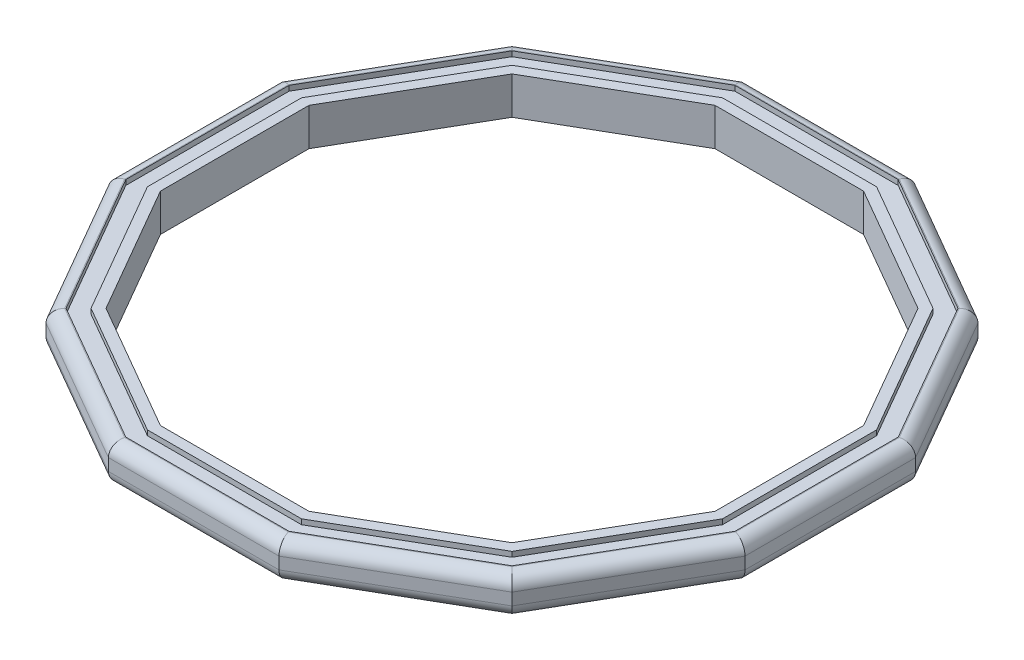
from build123d import *

# Parameters (mm, degrees)
EXTRUDE_1_DEPTH          = 4.4
CUT_EXTRUDE_1_DEPTH      = 0.6
FILLET_1_R               = 1.5
CUT_EXTRUDE_2_DEPTH      = 53.909660275
CUT_EXTRUDE_2_DEPTH_BACK = 53.909660275


with BuildPart() as part:
    # 스케치1 → 보스-돌출1 (new body)
    with BuildSketch(Plane(origin=(0, 0, 0), x_dir=(1, 0, 0), z_dir=(0, 1, 0))):
        Polygon((27.293187568, -27.293187568), (37.283187568, -9.99), (37.283187568, 9.99), (27.293187568, 27.293187568), (9.99, 37.283187568), (-9.99, 37.283187568), (-27.293187568, 27.293187568), (-37.283187568, 9.99), (-37.283187568, -9.99), (-27.293187568, -27.293187568), (-9.99, -37.283187568), (9.99, -37.283187568), align=None)
    extrude(amount=EXTRUDE_1_DEPTH)

    # 스케치2 → 컷-돌출1 (cut)
    with BuildSketch(Plane(origin=(0, 4.4, 0), x_dir=(1, 0, 0), z_dir=(0, 1, 0))):
        Polygon((-26.120860153, 26.120860153), (-35.681758538, 9.560898385), (-35.681758538, -9.560898385), (-26.120860153, -26.120860153), (-9.560898385, -35.681758538), (9.560898385, -35.681758538), (26.120860153, -26.120860153), (35.681758538, -9.560898385), (35.681758538, 9.560898385), (26.120860153, 26.120860153), (9.560898385, 35.681758538), (-9.560898385, 35.681758538), align=None)
        Polygon((24.656758538, -24.656758538), (33.681758538, -9.025), (33.681758538, 9.025), (24.656758538, 24.656758538), (9.025, 33.681758538), (-9.025, 33.681758538), (-24.656758538, 24.656758538), (-33.681758538, 9.025), (-33.681758538, -9.025), (-24.656758538, -24.656758538), (-9.025, -33.681758538), (9.025, -33.681758538), align=None, mode=Mode.SUBTRACT)
    cut_extrude_1 = extrude(amount=-CUT_EXTRUDE_1_DEPTH, mode=Mode.SUBTRACT)

    # 필렛1
    fillet_1_edges = [part.edges().sort_by_distance(p)[0] for p in [
        (0, 0, 37.283187568),
        (-18.641593784, 0, 32.288187568),
        (37.283187568, 4.4, 0),
        (-32.288187568, 0, 18.641593784),
        (-37.283187568, 0, 0),
        (-32.288187568, 0, -18.641593784),
        (-18.641593784, 0, -32.288187568),
        (0, 0, -37.283187568),
        (18.641593784, 0, -32.288187568),
        (32.288187568, 0, -18.641593784),
        (37.283187568, 0, 0),
        (32.288187568, 0, 18.641593784),
        (18.641593784, 0, 32.288187568),
        (32.288187568, 4.4, -18.641593784),
        (18.641593784, 4.4, -32.288187568),
        (0, 4.4, -37.283187568),
        (-18.641593784, 4.4, -32.288187568),
        (-32.288187568, 4.4, -18.641593784),
        (-37.283187568, 4.4, 0),
        (-32.288187568, 4.4, 18.641593784),
        (-18.641593784, 4.4, 32.288187568),
        (0, 4.4, 37.283187568),
        (18.641593784, 4.4, 32.288187568),
        (32.288187568, 4.4, 18.641593784),
    ]]
    fillet(fillet_1_edges, radius=FILLET_1_R)

    # 스케치3 → 컷-돌출2 (cut, two sides: drawn at the far end of the back side and taken through both)
    with BuildSketch(Plane(origin=(0, 4.4, 0), x_dir=(1, 0, 0), z_dir=(0, 1, 0)).offset(-CUT_EXTRUDE_2_DEPTH_BACK)):
        Polygon((23.778297569, 23.778297569), (8.703460969, 32.481758538), (-8.703460969, 32.481758538), (-23.778297569, 23.778297569), (-32.481758538, 8.703460969), (-32.481758538, -8.703460969), (-23.778297569, -23.778297569), (-8.703460969, -32.481758538), (8.703460969, -32.481758538), (23.778297569, -23.778297569), (32.481758538, -8.703460969), (32.481758538, 8.703460969), align=None)
    extrude(amount=CUT_EXTRUDE_2_DEPTH + CUT_EXTRUDE_2_DEPTH_BACK, mode=Mode.SUBTRACT)

    # 대칭 복사1: 컷-돌출1 across plane
    add(cut_extrude_1.mirror(Plane.ZX.offset(2.2)), mode=Mode.SUBTRACT)


solid = part.part
